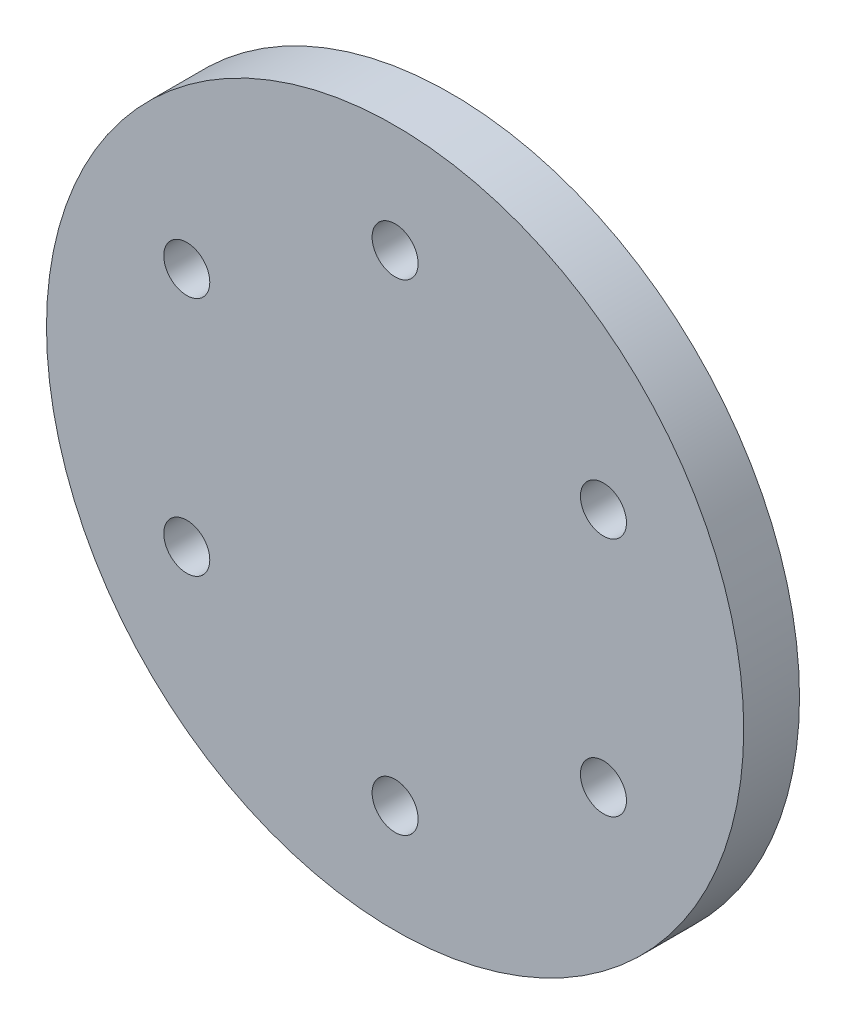
from build123d import *

# Parameters (mm, degrees)
SKETCH_1_R      = 25
SKETCH_1_R_2    = 1.65
EXTRUDE_1_DEPTH = 4


with BuildPart() as part:
    # 草图1 → 凸台-拉伸1 (new body)
    with BuildSketch(Plane.XY):
        Circle(SKETCH_1_R)
        with Locations((0, 17.25)):
            Circle(SKETCH_1_R_2, mode=Mode.SUBTRACT)
        with Locations((14.938938215, 8.625)):
            Circle(SKETCH_1_R_2, mode=Mode.SUBTRACT)
        with Locations((14.938938215, -8.625)):
            Circle(SKETCH_1_R_2, mode=Mode.SUBTRACT)
        with Locations((0, -17.25)):
            Circle(SKETCH_1_R_2, mode=Mode.SUBTRACT)
        with Locations((-14.938938215, -8.625)):
            Circle(SKETCH_1_R_2, mode=Mode.SUBTRACT)
        with Locations((-14.938938215, 8.625)):
            Circle(SKETCH_1_R_2, mode=Mode.SUBTRACT)
    extrude(amount=EXTRUDE_1_DEPTH)


solid = part.part
